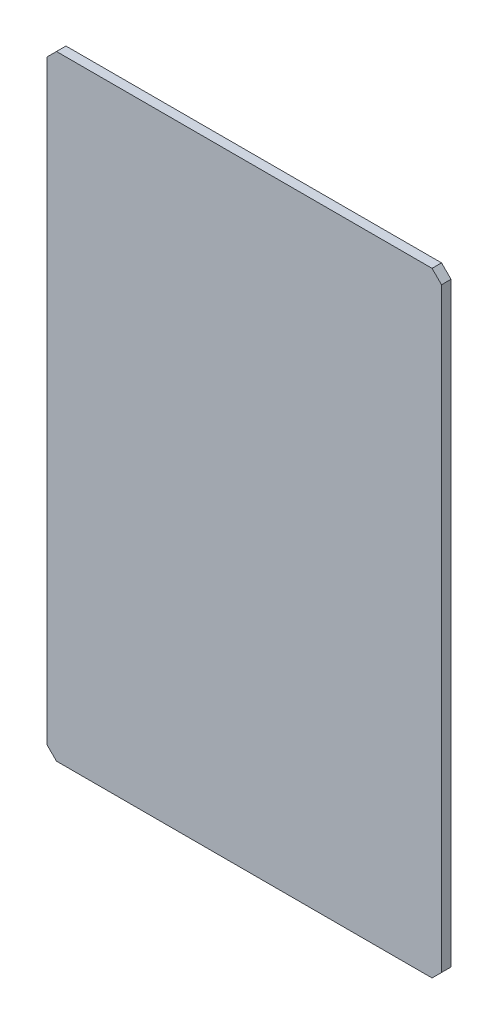
from build123d import *

# Parameters (mm, degrees)
SKETCH1_W           = 208
SKETCH1_H           = 324
BOSS_EXTRUDE1_DEPTH = 5
CHAMFER1_SIZE       = 5


with BuildPart() as part:
    # Sketch1 → Boss-Extrude1 (new body)
    with BuildSketch(Plane.XY):
        with Locations((23.5, -137)):
            Rectangle(SKETCH1_W, SKETCH1_H)
    extrude(amount=BOSS_EXTRUDE1_DEPTH)

    # Chamfer1
    chamfer1_edges = [part.edges().sort_by_distance(p)[0] for p in [
        (-80.5, 25, 2.5),
        (127.5, 25, 2.5),
        (127.5, -299, 2.5),
        (-80.5, -299, 2.5),
    ]]
    chamfer(chamfer1_edges, length=CHAMFER1_SIZE)


solid = part.part
